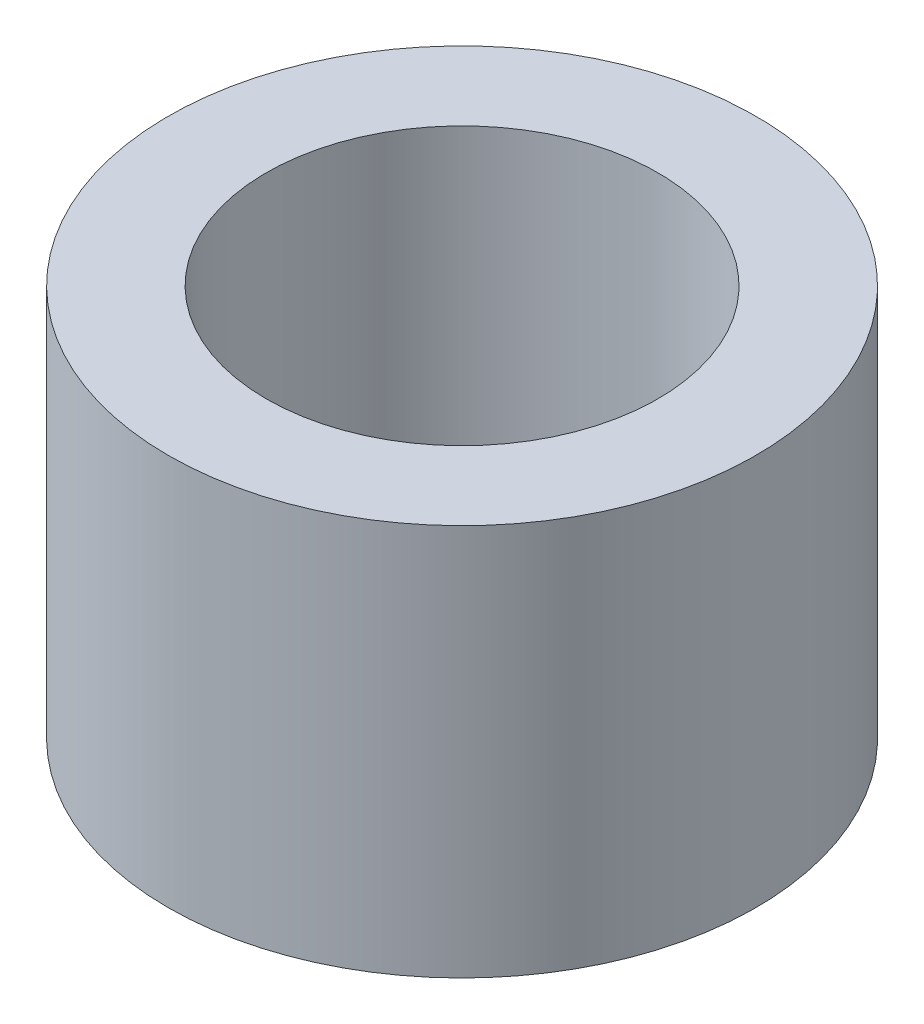
from build123d import *

# Parameters (mm, degrees)
SKETCH1_R           = 4.5
SKETCH1_R_2         = 3
BOSS_EXTRUDE1_DEPTH = 6


with BuildPart() as part:
    # Sketch1 → Boss-Extrude1 (new body)
    with BuildSketch(Plane(origin=(0, 0, 0), x_dir=(1, 0, 0), z_dir=(0, 1, 0))):
        with Locations(Location((0, 0, 0), (0, 0, 270))):
            Circle(SKETCH1_R)
        with Locations(Location((0, 0, 0), (0, 0, 270))):
            Circle(SKETCH1_R_2, mode=Mode.SUBTRACT)
    extrude(amount=BOSS_EXTRUDE1_DEPTH)


solid = part.part
